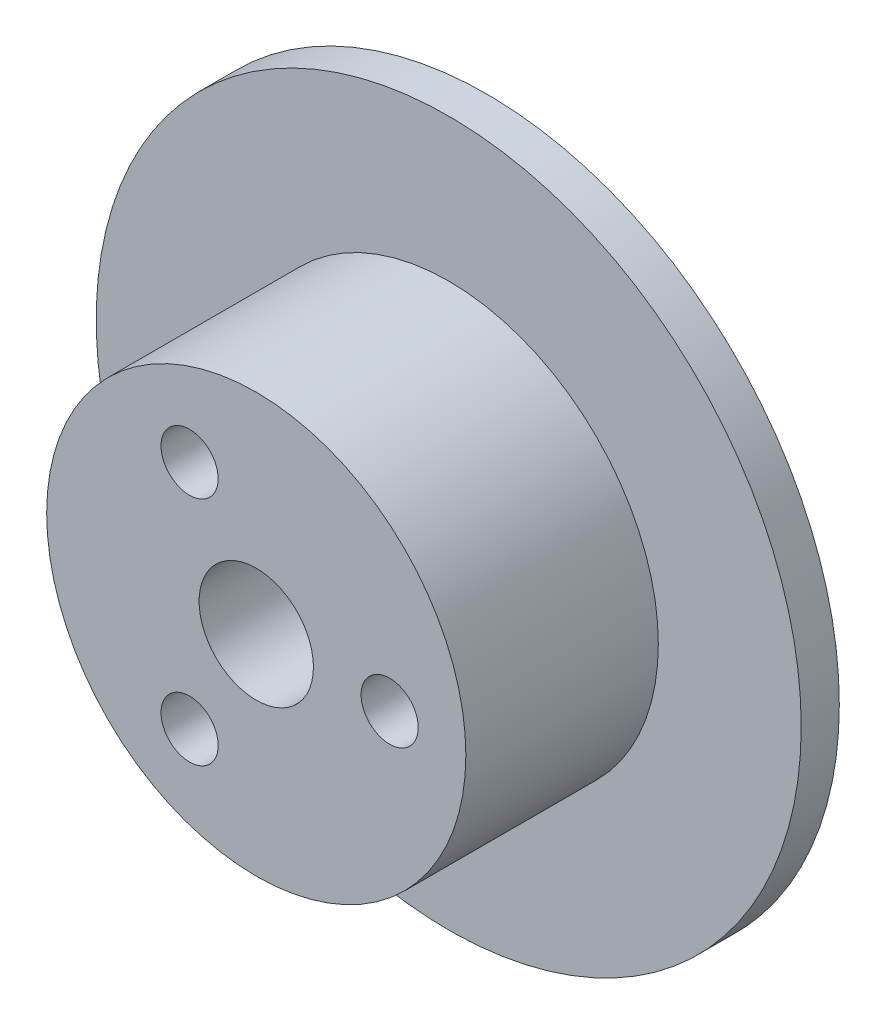
from build123d import *

# Parameters (mm, degrees)
SKETCH1_R           = 18.5
BOSS_EXTRUDE1_DEPTH = 3
SKETCH2_R           = 11
BOSS_EXTRUDE2_DEPTH = 2.5
SKETCH4_R           = 3.05
CUT_EXTRUDE1_DEPTH  = 27.734808771
SKETCH7_R           = 11
SKETCH7_R_2         = 3
BOSS_EXTRUDE3_DEPTH = 6.6
SKETCH9_R           = 1.5
CUT_EXTRUDE4_DEPTH  = 29.825509536
CUT_EXTRUDE5_START  = -1
SKETCH10_R          = 18.5
SKETCH10_R_2        = 11
CUT_EXTRUDE5_DEPTH  = 1


with BuildPart() as part:
    # Sketch1 → Boss-Extrude1 (new body)
    with BuildSketch(Plane.XY):
        Circle(SKETCH1_R)
    extrude(amount=BOSS_EXTRUDE1_DEPTH)

    # Sketch2 → Boss-Extrude2 (add)
    with BuildSketch(Plane.XY.offset(3)):
        Circle(SKETCH2_R)
    extrude(amount=BOSS_EXTRUDE2_DEPTH)

    # Sketch4 → Cut-Extrude1 (cut, through all)
    with BuildSketch(Plane(origin=(0, 0, 0), x_dir=(-1, 0, 0), z_dir=(0, 0, -1))):
        Circle(SKETCH4_R)
    extrude(amount=-CUT_EXTRUDE1_DEPTH, mode=Mode.SUBTRACT)

    # Sketch7 → Boss-Extrude3 (add)
    with BuildSketch(Plane.XY.offset(5.5)):
        Circle(SKETCH7_R)
        Circle(SKETCH7_R_2, mode=Mode.SUBTRACT)
    extrude(amount=BOSS_EXTRUDE3_DEPTH)

    # Sketch9 → Cut-Extrude4 (cut, through all)
    with BuildSketch(Plane.XY.offset(12.1)):
        with Locations((7, 0)):
            Circle(SKETCH9_R)
        with Locations((-3.5, -6.062177826)):
            Circle(SKETCH9_R)
        with Locations((-3.5, 6.062177826)):
            Circle(SKETCH9_R)
    extrude(amount=-CUT_EXTRUDE4_DEPTH, mode=Mode.SUBTRACT)

    # Sketch10 → Cut-Extrude5 (cut)
    with BuildSketch(Plane.XY.offset(3).offset(CUT_EXTRUDE5_START)):
        Circle(SKETCH10_R)
        Circle(SKETCH10_R_2, mode=Mode.SUBTRACT)
    extrude(amount=CUT_EXTRUDE5_DEPTH, mode=Mode.SUBTRACT)


solid = part.part
